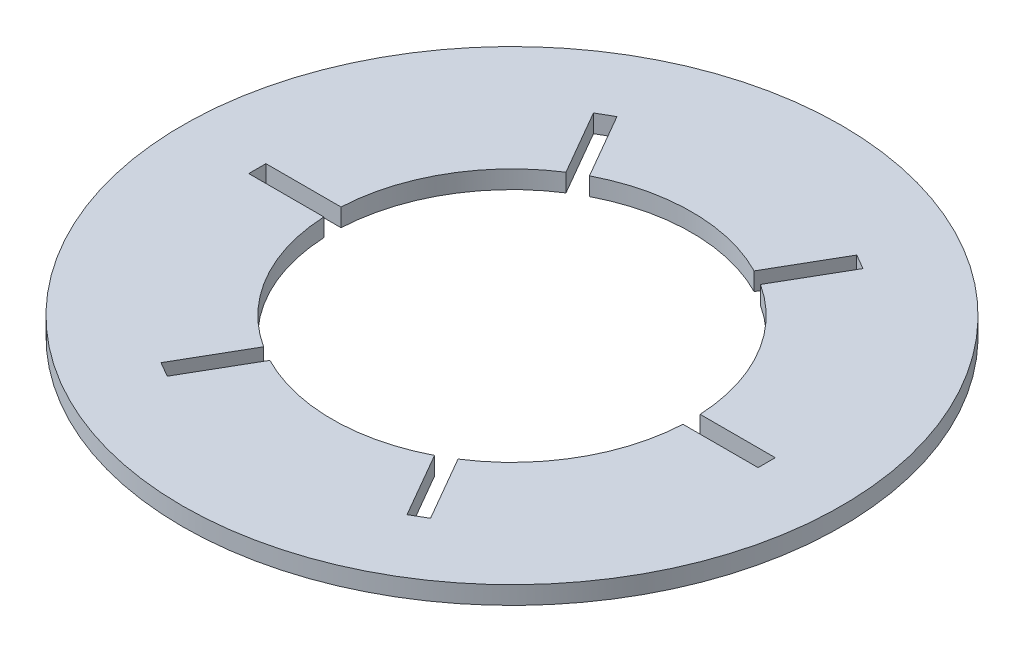
from build123d import *

# Parameters (mm, degrees)
SKETCH1_R           = 55
BOSS_EXTRUDE1_DEPTH = 3
SKETCH2_R           = 30
CUT_EXTRUDE1_DEPTH  = 3
SKETCH3_W           = 25
SKETCH3_H           = 2.87
CUT_EXTRUDE2_DEPTH  = 3
CIRPATTERN1_COUNT   = 6


with BuildPart() as part:
    # Sketch1 → Boss-Extrude1 (new body)
    with BuildSketch(Plane(origin=(0, 0, 0), x_dir=(1, 0, 0), z_dir=(0, 1, 0))):
        with Locations(Location((0, 0, 0), (0, 0, 270))):
            Circle(SKETCH1_R)
    extrude(amount=BOSS_EXTRUDE1_DEPTH)

    # Sketch2 → Cut-Extrude1 (cut)
    with BuildSketch(Plane(origin=(0, 3, 0), x_dir=(1, 0, 0), z_dir=(0, 1, 0))):
        with Locations(Location((0, 0, 0), (0, 0, 270))):
            Circle(SKETCH2_R)
    extrude(amount=-CUT_EXTRUDE1_DEPTH, mode=Mode.SUBTRACT)

    # Sketch3 → Cut-Extrude2 (cut)
    with BuildSketch(Plane(origin=(0, 3, 0), x_dir=(1, 0, 0), z_dir=(0, 1, 0))):
        with Locations((-30, 0)):
            Rectangle(SKETCH3_W, SKETCH3_H)
    cut_extrude2 = extrude(amount=-CUT_EXTRUDE2_DEPTH, mode=Mode.SUBTRACT)

    # CirPattern1: Cut-Extrude2 ×6 about axis
    cirpattern1_axis = Axis((0, 0, 0), (0, 1, 0))
    for i in range(1, CIRPATTERN1_COUNT):
        add(cut_extrude2.rotate(cirpattern1_axis, i * 360 / CIRPATTERN1_COUNT), mode=Mode.SUBTRACT)


solid = part.part
